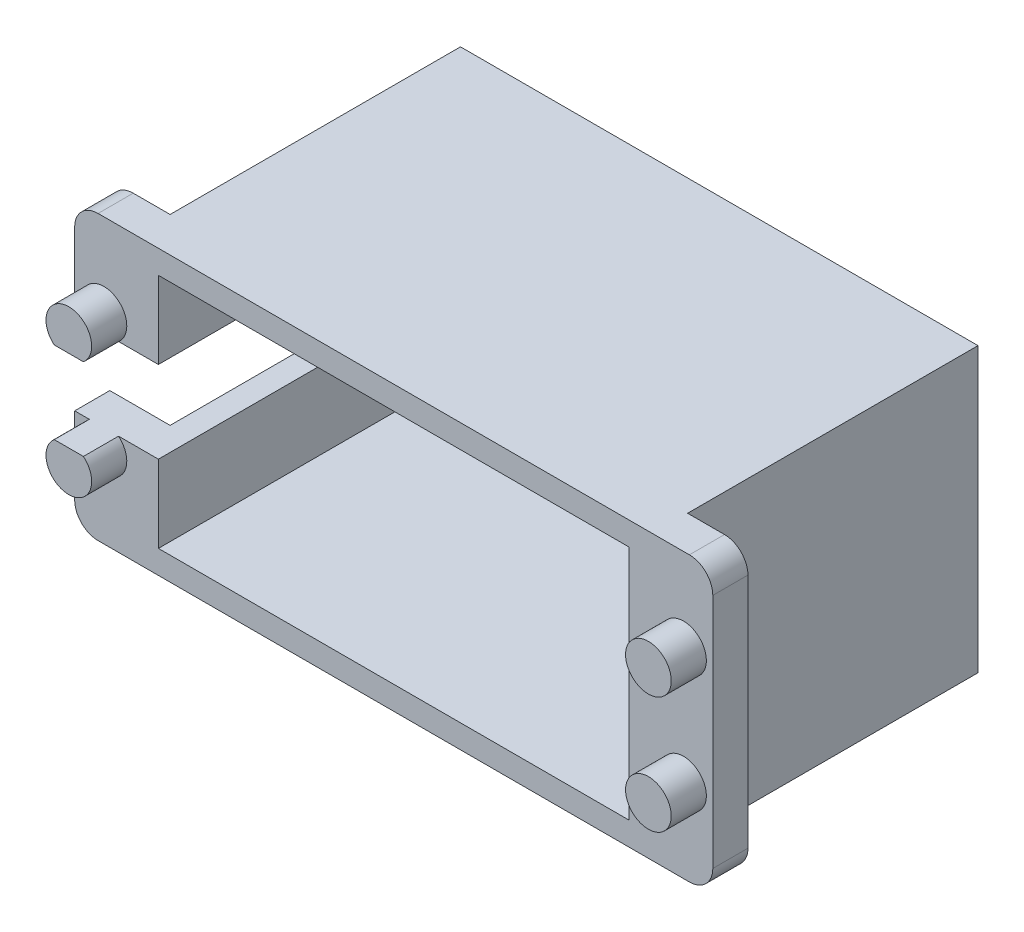
from build123d import *

# Parameters (mm, degrees)
BOSS_EXTRU_1_DEPTH = 27.8
ESQUISSE3_W        = 2
ESQUISSE3_H        = 7
BOSS_EXTRU_2_DEPTH = 6.44
BOSS_EXTRU_3_DEPTH = 3
ESQUISSE7_R        = 1.95
BOSS_EXTRU_4_DEPTH = 3


with BuildPart() as part:
    # Esquisse1 → Boss.-Extru.1 (new body)
    with BuildSketch(Plane.XY):
        Polygon((-2, 22.2), (-2, 13.6), (0, 13.6), (0, 20.2), (40.2, 20.2), (40.2, 0), (0, 0), (0, 6.6), (-2, 6.6), (-2, -2), (42.2, -2), (42.2, 22.2), align=None)
    extrude(amount=BOSS_EXTRU_1_DEPTH)

    # Esquisse3 → Boss.-Extru.2 (add)
    with BuildSketch(Plane(origin=(0, 0, 0), x_dir=(-1, 0, 0), z_dir=(0, 0, -1))):
        with Locations((1, 10.1)):
            Rectangle(ESQUISSE3_W, ESQUISSE3_H)
    extrude(amount=-BOSS_EXTRU_2_DEPTH)

    # Esquisse5 → Boss.-Extru.3 (add)
    with BuildSketch(Plane.XY.offset(27.8)):
        with BuildLine():
            Line((-2, 13.6), (-2, 22.2))
            Line((-2, 22.2), (-5.15, 22.2))
            ThreePointArc((-5.15, 22.2), (-6.564213562, 21.614213562), (-7.15, 20.2))
            Line((-7.15, 20.2), (-7.15, 13.6))
            Line((-7.15, 13.6), (-2, 13.6))
        make_face()
        with BuildLine():
            Line((-2, -2), (-2, 6.6))
            Line((-2, 6.6), (-7.15, 6.6))
            Line((-7.15, 6.6), (-7.15, 0))
            ThreePointArc((-7.15, 0), (-6.564213562, -1.414213562), (-5.15, -2))
            Line((-5.15, -2), (-2, -2))
        make_face()
        with BuildLine():
            Line((42.2, -2), (45.35, -2))
            ThreePointArc((45.35, -2), (46.764213562, -1.414213562), (47.35, 0))
            Line((47.35, 0), (47.35, 20.2))
            ThreePointArc((47.35, 20.2), (46.764213562, 21.614213562), (45.35, 22.2))
            Line((45.35, 22.2), (42.2, 22.2))
            Line((42.2, 22.2), (42.2, -2))
        make_face()
    extrude(amount=-BOSS_EXTRU_3_DEPTH)

    # Esquisse7 → Boss.-Extru.4 (add)
    with BuildSketch(Plane.XY.offset(27.8)):
        with Locations(Location((44.85, 5.1, 0), (0, 0, 180))):
            Circle(ESQUISSE7_R)
        with Locations(Location((44.85, 15.1, 0), (0, 0, 180))):
            Circle(ESQUISSE7_R)
        with BuildLine():
            Line((-5.895993579, 13.6), (-3.404006421, 13.6))
            ThreePointArc((-3.404006421, 13.6), (-4.65, 17.05), (-5.895993579, 13.6))
        make_face()
        with BuildLine():
            Line((-5.895993579, 6.6), (-3.404006421, 6.6))
            ThreePointArc((-3.404006421, 6.6), (-4.65, 3.15), (-5.895993579, 6.6))
        make_face()
    extrude(amount=BOSS_EXTRU_4_DEPTH)


solid = part.part
